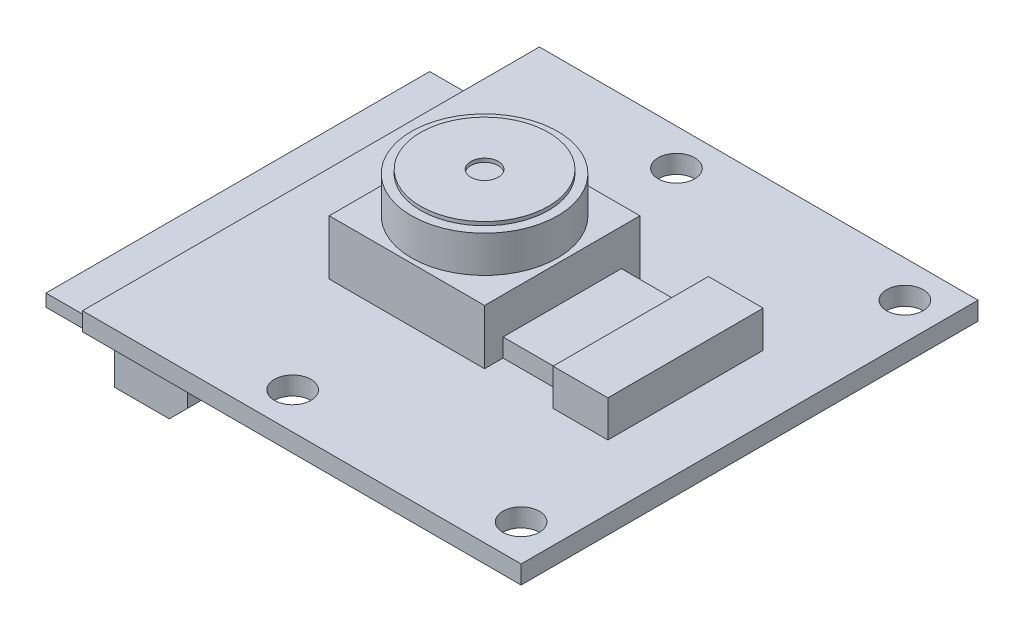
from build123d import *

# Parameters (mm, degrees)
SKETCH_1_W          = 24
SKETCH_1_H          = 25
EXTRUDE_1_DEPTH     = 1
SKETCH_2_W          = 8.5
SKETCH_2_H          = 8.5
EXTRUDE_2_DEPTH     = 3
SKETCH_3_R          = 4
EXTRUDE_3_DEPTH     = 2
SKETCH_4_W          = 3
SKETCH_4_H          = 8.5
EXTRUDE_4_DEPTH     = 2
SKETCH_5_W          = 3.75
SKETCH_5_H          = 6.47612255
EXTRUDE_5_DEPTH     = 1
SKETCH_6_W          = 4
SKETCH_6_H          = 23.5
EXTRUDE_6_DEPTH     = 2.5
CHAMFER_1_SIZE      = 1
SKETCH_7_W          = 20.993550262
SKETCH_7_H          = 0.673046144
EXTRUDE_7_DEPTH     = 5
SKETCH_8_R          = 1
CUT_EXTRUDE_1_DEPTH = 1
SKETCH_9_R          = 3.5
EXTRUDE_8_DEPTH     = 0.2
SKETCH_10_R         = 0.75
CUT_EXTRUDE_2_DEPTH = 0.2


with BuildPart() as part:
    # 草图1 → 凸台-拉伸1 (new body)
    with BuildSketch(Plane(origin=(0, 0, 0), x_dir=(1, 0, 0), z_dir=(0, 1, 0))):
        Rectangle(SKETCH_1_W, SKETCH_1_H)
    extrude(amount=EXTRUDE_1_DEPTH)

    # 草图2 → 凸台-拉伸2 (add)
    with BuildSketch(Plane(origin=(0, 1, 0), x_dir=(1, 0, 0), z_dir=(0, 1, 0))):
        with Locations((-2.5, 0)):
            Rectangle(SKETCH_2_W, SKETCH_2_H)
    extrude(amount=EXTRUDE_2_DEPTH)

    # 草图3 → 凸台-拉伸3 (add)
    with BuildSketch(Plane(origin=(0, 4, 0), x_dir=(1, 0, 0), z_dir=(0, 1, 0))):
        with Locations(Location((-2.5, 0, 0), (0, 0, 270))):
            Circle(SKETCH_3_R)
    extrude(amount=EXTRUDE_3_DEPTH)

    # 草图4 → 凸台-拉伸4 (add)
    with BuildSketch(Plane(origin=(0, 1, 0), x_dir=(1, 0, 0), z_dir=(0, 1, 0))):
        with Locations((7, -0.004190874)):
            Rectangle(SKETCH_4_W, SKETCH_4_H)
    extrude(amount=EXTRUDE_4_DEPTH)

    # 草图5 → 凸台-拉伸5 (add)
    with BuildSketch(Plane(origin=(0, 1, 0), x_dir=(1, 0, 0), z_dir=(0, 1, 0))):
        with Locations((3.625, 0)):
            Rectangle(SKETCH_5_W, SKETCH_5_H)
    extrude(amount=EXTRUDE_5_DEPTH)

    # 草图6 → 凸台-拉伸6 (add)
    with BuildSketch(Plane(origin=(0, 0, 0), x_dir=(1, 0, 0), z_dir=(0, 1, 0))):
        with Locations((-9, 0)):
            Rectangle(SKETCH_6_W, SKETCH_6_H)
    extrude(amount=-EXTRUDE_6_DEPTH)

    # 倒角1
    chamfer_1_edges = [part.edges().sort_by_distance(p)[0] for p in [
        (-7, -2.5, 0),
    ]]
    chamfer(chamfer_1_edges, length=CHAMFER_1_SIZE)

    # 草图7 → 凸台-拉伸7 (add)
    with BuildSketch(Plane.ZY.offset(11)):
        with Locations((0, -1.5)):
            Rectangle(SKETCH_7_W, SKETCH_7_H)
    extrude(amount=EXTRUDE_7_DEPTH)

    # 草图8 → 切除-拉伸1 (cut)
    with BuildSketch(Plane(origin=(0, 1, 0), x_dir=(1, 0, 0), z_dir=(0, 1, 0))):
        with Locations(Location((10, -10.5, 0), (0, 0, 270))):
            Circle(SKETCH_8_R)
        with Locations(Location((10, 10.5, 0), (0, 0, 270))):
            Circle(SKETCH_8_R)
        with Locations(Location((-2.5, -10.5, 0), (0, 0, 270))):
            Circle(SKETCH_8_R)
        with Locations(Location((-2.5, 10.5, 0), (0, 0, 270))):
            Circle(SKETCH_8_R)
    extrude(amount=-CUT_EXTRUDE_1_DEPTH, mode=Mode.SUBTRACT)

    # 草图9 → 凸台-拉伸8 (add)
    with BuildSketch(Plane(origin=(0, 6, 0), x_dir=(1, 0, 0), z_dir=(0, 1, 0))):
        with Locations(Location((-2.5, 0, 0), (0, 0, 270))):
            Circle(SKETCH_9_R)
    extrude(amount=EXTRUDE_8_DEPTH)

    # 草图10 → 切除-拉伸2 (cut)
    with BuildSketch(Plane(origin=(0, 6.2, 0), x_dir=(1, 0, 0), z_dir=(0, 1, 0))):
        with Locations(Location((-2.5, 0, 0), (0, 0, 270))):
            Circle(SKETCH_10_R)
    extrude(amount=-CUT_EXTRUDE_2_DEPTH, mode=Mode.SUBTRACT)


solid = part.part
